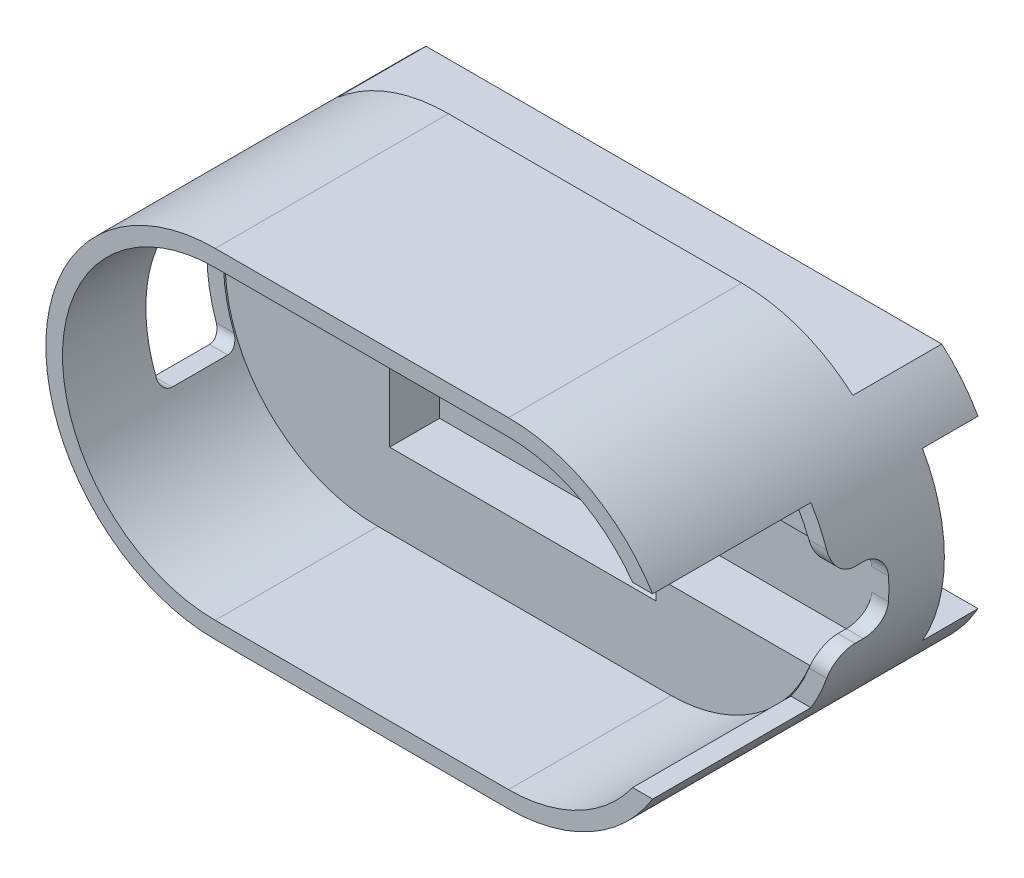
from build123d import *

# Parameters (mm, degrees)
BOSS_EXTRUDE1_DEPTH = 19
BOSS_EXTRUDE2_DEPTH = 2
BOSS_EXTRUDE3_DEPTH = 4.5
SKETCH4_W           = 4.75
SKETCH4_H           = 6
SKETCH4_W_2         = 14.25
SKETCH4_H_2         = 16
CUT_EXTRUDE1_DEPTH  = 49.452157546
SKETCH5_W           = 7
SKETCH5_H           = 12
CUT_EXTRUDE2_DEPTH  = 49.452157546
FILLET1_R           = 1
SKETCH6_R           = 1.6
BOSS_EXTRUDE4_DEPTH = 3
BOSS_EXTRUDE7_DEPTH = 8
FILLET2_R           = 2
CUT_EXTRUDE3_START  = -10
SKETCH9_R           = 1.6
CUT_EXTRUDE3_DEPTH  = 10
CUT_EXTRUDE4_START  = -1
SKETCH11_R          = 2.065
CUT_EXTRUDE4_DEPTH  = 3


with BuildPart() as part:
    # Sketch1 → Boss-Extrude1 (new body)
    with BuildSketch(Plane.XY):
        with BuildLine():
            Line((-34.384444189, 18.719216619), (-7.984444189, 18.719216619))
            ThreePointArc((-7.984444189, 18.719216619), (7.265555811, 3.469216619), (-7.984444189, -11.780783381))
            Line((-7.984444189, -11.780783381), (-34.384444189, -11.780783381))
            ThreePointArc((-34.384444189, -11.780783381), (-49.634444189, 3.469216619), (-34.384444189, 18.719216619))
        make_face()
        with BuildLine():
            Line((-34.384444189, 17.219216619), (-7.984444189, 17.219216619))
            ThreePointArc((-7.984444189, 17.219216619), (5.765555811, 3.469216619), (-7.984444189, -10.280783381))
            Line((-7.984444189, -10.280783381), (-34.384444189, -10.280783381))
            ThreePointArc((-34.384444189, -10.280783381), (-48.134444189, 3.469216619), (-34.384444189, 17.219216619))
        make_face(mode=Mode.SUBTRACT)
    extrude(amount=BOSS_EXTRUDE1_DEPTH)



with BuildPart() as body_2:
    # Sketch2 → Boss-Extrude2 (new body)
    with BuildSketch(Plane(origin=(0, 0, 0), x_dir=(-1, 0, 0), z_dir=(0, 0, -1))):
        with BuildLine():
            Line((34.384444189, -11.780783381), (7.984444189, -11.780783381))
            ThreePointArc((7.984444189, -11.780783381), (-7.265555811, 3.469216619), (7.984444189, 18.719216619))
            Line((7.984444189, 18.719216619), (34.384444189, 18.719216619))
            ThreePointArc((34.384444189, 18.719216619), (49.634444189, 3.469216619), (34.384444189, -11.780783381))
        make_face()
    extrude(amount=BOSS_EXTRUDE2_DEPTH)


with BuildPart() as part_1:
    add(part.part)

    add(body_2.part)  # Boss-Extrude3 merges body 2
    # Sketch3 → Boss-Extrude3 (add)
    with BuildSketch(Plane.XY):
        with BuildLine():
            Line((-22.664695889, -3.430783381), (-33.184444189, -3.430783381))
            Line((-33.184444189, -3.430783381), (-33.184444189, 10.369216619))
            Line((-33.184444189, 10.369216619), (-19.704192488, 10.369216619))
            Line((-19.704192488, 10.369216619), (-9.184444189, 10.369216619))
            Line((-9.184444189, 10.369216619), (-9.184444189, 8.469216619))
            Line((-9.184444189, 8.469216619), (4.663184056, 8.469216619))
            ThreePointArc((4.663184056, 8.469216619), (-0.337155761, 14.715615149), (-7.984444189, 17.069308538))
            Line((-7.984444189, 17.069308538), (-34.384444189, 17.069308538))
            ThreePointArc((-34.384444189, 17.069308538), (-47.984536108, 3.469216619), (-34.384444189, -10.1308753))
            Line((-34.384444189, -10.1308753), (-7.984444189, -10.1308753))
            ThreePointArc((-7.984444189, -10.1308753), (-0.337155761, -7.777181911), (4.663184056, -1.530783381))
            Line((4.663184056, -1.530783381), (-9.184444189, -1.530783381))
            Line((-9.184444189, -1.530783381), (-9.184444189, -3.430783381))
            Line((-9.184444189, -3.430783381), (-19.704192488, -3.430783381))
            Line((-19.704192488, -3.430783381), (-22.664695889, -3.430783381))
        make_face()
    extrude(amount=BOSS_EXTRUDE3_DEPTH)

    # Sketch4 → Cut-Extrude1 (cut, through all)
    with BuildSketch(Plane.ZY.offset(9.184444189)):
        with Locations((2.375, 3.469216619)):
            Rectangle(SKETCH4_W, SKETCH4_H)
        with Locations((11.875, 3.469216619)):
            Rectangle(SKETCH4_W_2, SKETCH4_H_2)
    extrude(amount=-CUT_EXTRUDE1_DEPTH, mode=Mode.SUBTRACT)

    # Sketch5 → Cut-Extrude2 (cut, through all)
    with BuildSketch(Plane(origin=(-33.184444189, 0, 0), x_dir=(0, 0, -1), z_dir=(1, 0, 0))):
        with Locations((-8, 3.469216619)):
            Rectangle(SKETCH5_W, SKETCH5_H)
    extrude(amount=-CUT_EXTRUDE2_DEPTH, mode=Mode.SUBTRACT)

    # Fillet1
    fillet1_edges = [part_1.edges().sort_by_distance(p)[0] for p in [
        (-47.580403151, -2.530783381, 11.5),
        (-47.580403151, 9.469216619, 11.5),
        (-47.580403151, 9.469216619, 4.5),
        (-47.580403151, -2.530783381, 4.5),
    ]]
    fillet(fillet1_edges, radius=FILLET1_R)

    # Sketch6 → Boss-Extrude4 (add)
    with BuildSketch(Plane(origin=(0, 0, -2), x_dir=(-1, 0, 0), z_dir=(0, 0, -1))):
        with BuildLine():
            ThreePointArc((47.662715914, -4.030783381), (49.634444189, 3.469216619), (47.662715914, 10.969216619))
            Line((47.662715914, 10.969216619), (-5.293827536, 10.969216619))
            ThreePointArc((-5.293827536, 10.969216619), (-7.265555811, 3.469216619), (-5.293827536, -4.030783381))
            Line((-5.293827536, -4.030783381), (47.662715914, -4.030783381))
        make_face()
        with Locations((21.184444189, 3.469216619)):
            Circle(SKETCH6_R, mode=Mode.SUBTRACT)
    extrude(amount=BOSS_EXTRUDE4_DEPTH)

    # Sketch10 → Boss-Extrude7 (add)
    with BuildSketch(Plane(origin=(0, 0, -2), x_dir=(-1, 0, 0), z_dir=(0, 0, -1))):
        with BuildLine():
            Line((-5.293827536, -4.030783381), (47.662715914, -4.030783381))
            ThreePointArc((47.662715914, -4.030783381), (46.201857789, -6.169830834), (44.400057001, -8.030783381))
            Line((44.400057001, -8.030783381), (-2.031168623, -8.030783381))
            ThreePointArc((-2.031168623, -8.030783381), (-3.832969412, -6.169830834), (-5.293827536, -4.030783381))
        make_face()
        with BuildLine():
            Line((-5.293827536, 10.969216619), (47.662715914, 10.969216619))
            ThreePointArc((47.662715914, 10.969216619), (46.201857789, 13.108264072), (44.400057001, 14.969216619))
            Line((44.400057001, 14.969216619), (-2.031168623, 14.969216619))
            ThreePointArc((-2.031168623, 14.969216619), (-3.832969412, 13.108264072), (-5.293827536, 10.969216619))
        make_face()
    extrude(amount=BOSS_EXTRUDE7_DEPTH)

    # Fillet2
    fillet2_edges = [part_1.edges().sort_by_distance(p)[0] for p in [
        (6.200927538, 0.469216619, 0),
        (6.200927538, 6.469216619, 0),
        (6.200927538, 6.469216619, 4.75),
        (6.200927538, 0.469216619, 4.75),
    ]]
    fillet(fillet2_edges, radius=FILLET2_R)

    # Sketch9 → Cut-Extrude3 (cut)
    with BuildSketch(Plane(origin=(0, 0, -2), x_dir=(-1, 0, 0), z_dir=(0, 0, -1)).offset(CUT_EXTRUDE3_START)):
        with Locations((21.184444189, 3.469216619)):
            Circle(SKETCH9_R)
    extrude(amount=CUT_EXTRUDE3_DEPTH, mode=Mode.SUBTRACT)

    # Sketch11 → Cut-Extrude4 (cut)
    with BuildSketch(Plane.XY.offset(CUT_EXTRUDE4_START)):
        with Locations((-21.184444189, 3.469216619)):
            Circle(SKETCH11_R)
    extrude(amount=-CUT_EXTRUDE4_DEPTH, mode=Mode.SUBTRACT)


solid = part_1.part
